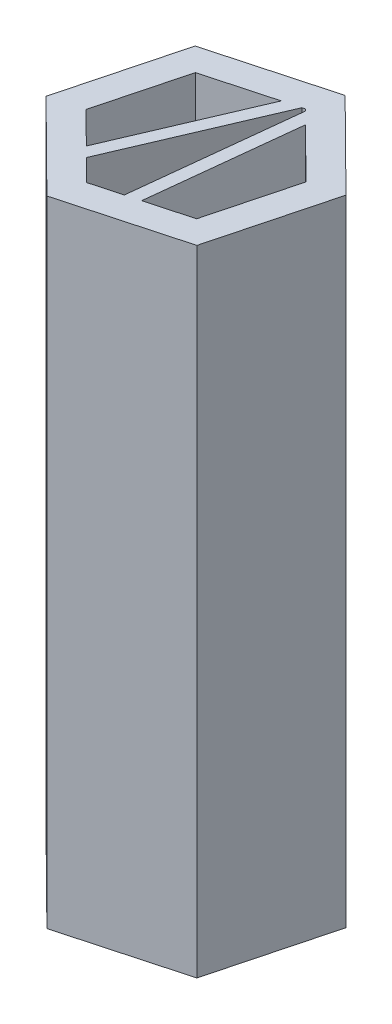
from build123d import *

# Parameters (mm, degrees)
BOSS_EXTRUDE1_DEPTH = 45
BOSS_EXTRUDE2_DEPTH = 45


with BuildPart() as part:
    # Sketch1 → Boss-Extrude1 (new body)
    with BuildSketch(Plane(origin=(0, 0, 0), x_dir=(1, 0, 0), z_dir=(0, 1, 0))):
        Polygon((6.154419136, -6.092874945), (8.353794053, 2.283445845), (2.199374916, 8.37632079), (-6.154419136, 6.092874945), (-8.353794053, -2.283445845), (-2.199374916, -8.37632079), align=None)
        Polygon((-1.612874939, -6.142635246), (4.5132407, -4.468108293), (6.126115639, 1.674526953), (1.612874939, 6.142635246), (-4.5132407, 4.468108293), (-6.126115639, -1.674526953), align=None, mode=Mode.SUBTRACT)
    extrude(amount=BOSS_EXTRUDE1_DEPTH)

    # Sketch2 → Boss-Extrude2 (add)
    with BuildSketch(Plane(origin=(0, 45, 0), x_dir=(1, 0, 0), z_dir=(0, 1, 0))):
        Polygon((-3.869495289, -3.9085811), (0.274314049, 5.776749843), (1.419952329, 6.089901323), (-3.15884418, -4.612125697), align=None)
        Polygon((1.450182881, -5.305371769), (2.599021437, 5.166350213), (1.75500516, 6.001926326), (0.485569832, -5.569041384), align=None)
    extrude(amount=-BOSS_EXTRUDE2_DEPTH)


solid = part.part
